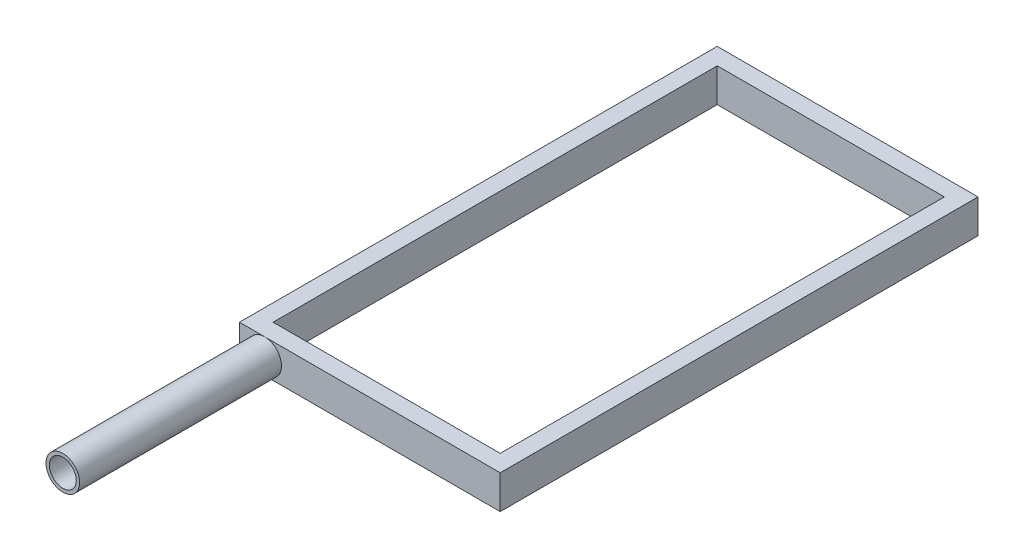
from build123d import *

# Parameters (mm, degrees)
SCHIZZO1_W                   = 155
SCHIZZO1_H                   = 284
SCHIZZO1_W_2                 = 135
SCHIZZO1_H_2                 = 264
ESTRUSIONE_SOTTILE1_DEPTH    = 20
SCHIZZO2_R                   = 10
SCHIZZO2_R_2                 = 8
ESTRUSIONE_ESTRUSIONE1_DEPTH = 120


with BuildPart() as part:
    # Schizzo1 → Estrusione-Sottile1 (new body)
    with BuildSketch(Plane(origin=(0, 0, 0), x_dir=(1, 0, 0), z_dir=(0, 1, 0))):
        with Locations((67.5, 132)):
            Rectangle(SCHIZZO1_W, SCHIZZO1_H)
        with Locations((67.5, 132)):
            Rectangle(SCHIZZO1_W_2, SCHIZZO1_H_2, mode=Mode.SUBTRACT)
    extrude(amount=ESTRUSIONE_SOTTILE1_DEPTH)

    # Schizzo2 → Estrusione-Estrusione1 (add)
    with BuildSketch(Plane.XY.offset(10)):
        with Locations(Location((5, 10, 0), (0, 0, 270))):
            Circle(SCHIZZO2_R)
        with Locations((5, 10)):
            Circle(SCHIZZO2_R_2, mode=Mode.SUBTRACT)
    extrude(amount=ESTRUSIONE_ESTRUSIONE1_DEPTH)


solid = part.part
